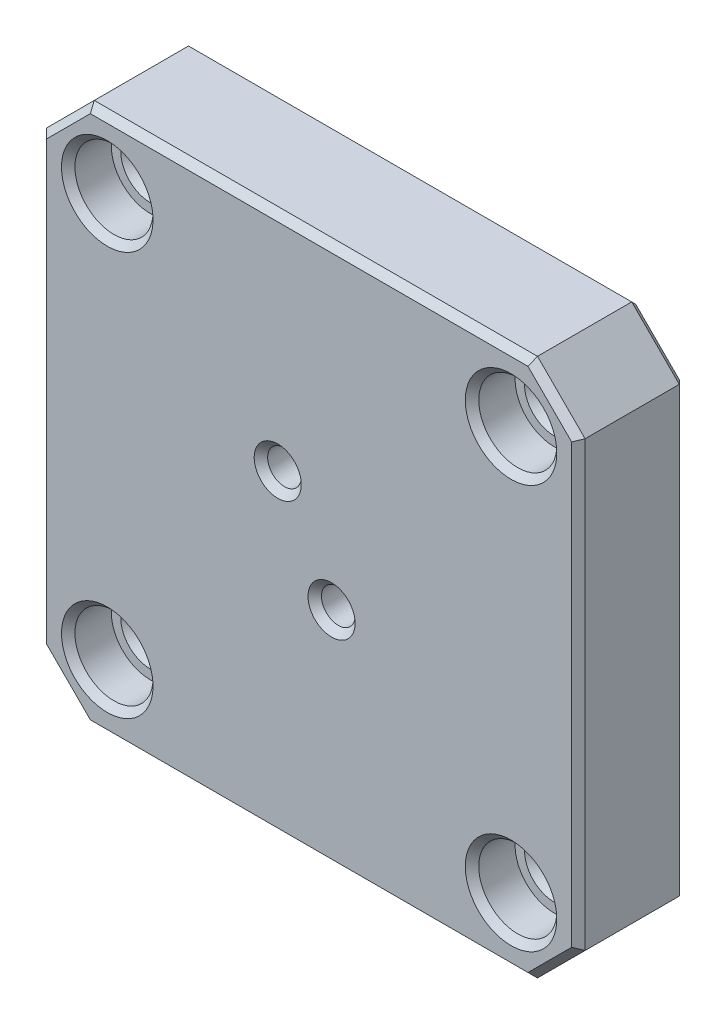
from build123d import *

# Parameters (mm, degrees)
SKETCH1_W           = 40
SKETCH1_H           = 40
BOSS_EXTRUDE1_DEPTH = 8
SKETCH2_R           = 1.7
CUT_EXTRUDE1_DEPTH  = 58.131427428
SKETCH3_R           = 1.25
CUT_EXTRUDE2_DEPTH  = 58.131427428
SKETCH4_R           = 2.9
CUT_EXTRUDE3_DEPTH  = 3.2
CHAMFER1_SIZE       = 3.536
CHAMFER2_SIZE       = 0.5


with BuildPart() as part:
    # Sketch1 → Boss-Extrude1 (new body)
    with BuildSketch(Plane.XY):
        with Locations((20, 20)):
            Rectangle(SKETCH1_W, SKETCH1_H)
    extrude(amount=BOSS_EXTRUDE1_DEPTH)

    # Sketch2 → Cut-Extrude1 (cut, through all)
    with BuildSketch(Plane.XY.offset(8)):
        with Locations((5, 35)):
            Circle(SKETCH2_R)
        with Locations((35, 35)):
            Circle(SKETCH2_R)
        with Locations((5, 5)):
            Circle(SKETCH2_R)
        with Locations((35, 5)):
            Circle(SKETCH2_R)
    extrude(amount=-CUT_EXTRUDE1_DEPTH, mode=Mode.SUBTRACT)

    # Sketch3 → Cut-Extrude2 (cut, through all)
    with BuildSketch(Plane.XY.offset(8)):
        with Locations((17.66557685, 23.464101615)):
            Circle(SKETCH3_R)
        with Locations((21.66557685, 16.535898385)):
            Circle(SKETCH3_R)
    extrude(amount=-CUT_EXTRUDE2_DEPTH, mode=Mode.SUBTRACT)

    # Sketch4 → Cut-Extrude3 (cut)
    with BuildSketch(Plane.XY.offset(8)):
        with Locations((5, 35)):
            Circle(SKETCH4_R)
        with Locations((35, 35)):
            Circle(SKETCH4_R)
        with Locations((5, 5)):
            Circle(SKETCH4_R)
        with Locations((35, 5)):
            Circle(SKETCH4_R)
    extrude(amount=-CUT_EXTRUDE3_DEPTH, mode=Mode.SUBTRACT)

    # Chamfer1
    chamfer1_edges = [part.edges().sort_by_distance(p)[0] for p in [
        (0, 40, 4),
        (40, 40, 4),
        (40, 0, 4),
        (0, 0, 4),
    ]]
    chamfer(chamfer1_edges, length=CHAMFER1_SIZE)

    # Chamfer2
    chamfer2_edges = [part.edges().sort_by_distance(p)[0] for p in [
        (33.3, 35, 0),
        (3.3, 5, 0),
        (33.3, 5, 0),
        (3.3, 35, 0),
        (16.41557685, 23.464101615, 0),
        (16.41557685, 23.464101615, 8),
        (20.41557685, 16.535898385, 0),
        (20.41557685, 16.535898385, 8),
        (32.1, 35, 8),
        (33.3, 35, 4.8),
        (2.1, 5, 8),
        (3.3, 5, 4.8),
        (32.1, 5, 8),
        (33.3, 5, 4.8),
        (2.1, 35, 8),
        (3.3, 35, 4.8),
        (0, 20, 0),
        (0, 20, 8),
        (20, 40, 0),
        (40, 20, 0),
        (20, 0, 0),
        (1.768, 1.768, 0),
        (38.232, 1.768, 0),
        (38.232, 38.232, 0),
        (1.768, 38.232, 0),
        (20, 40, 8),
        (20, 0, 8),
        (40, 20, 8),
        (1.768, 1.768, 8),
        (38.232, 1.768, 8),
        (38.232, 38.232, 8),
        (1.768, 38.232, 8),
    ]]
    chamfer(chamfer2_edges, length=CHAMFER2_SIZE)


solid = part.part
